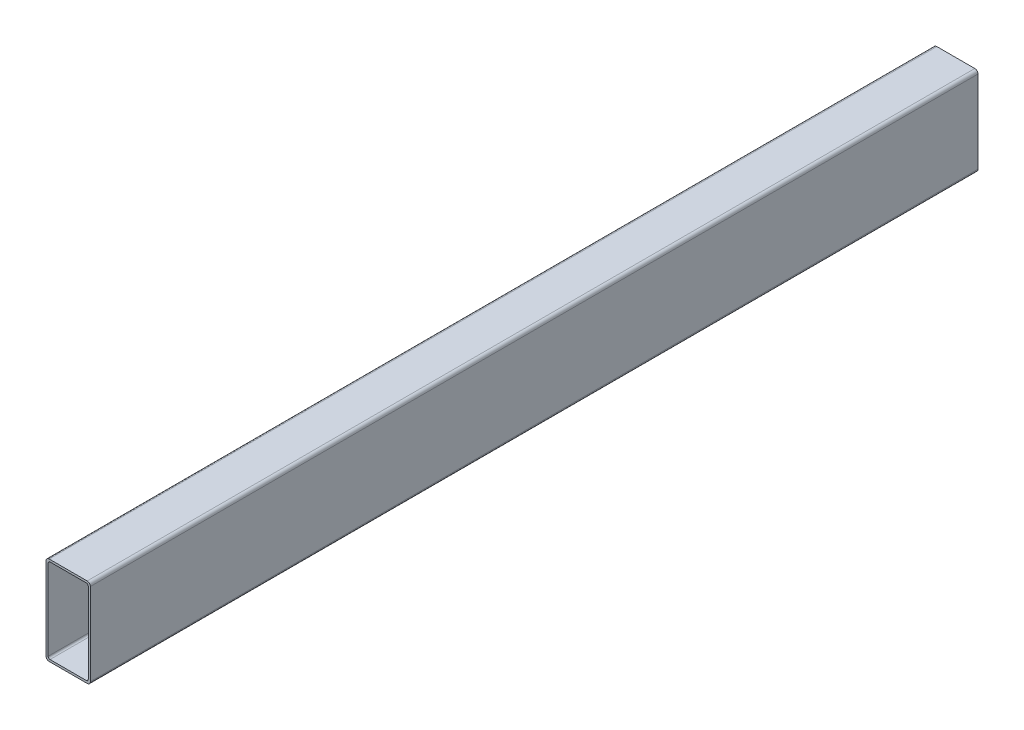
from build123d import *

# Parameters (mm, degrees)
EXTRUDE_1_DEPTH = 500


with BuildPart() as part:
    # 草图1 → 拉伸1 (new body)
    with BuildSketch(Plane.XY):
        with BuildLine():
            Line((-10.704, 25), (10.704, 25))
            ThreePointArc((10.704, 25), (11.973963779, 24.473963779), (12.5, 23.204))
            Line((12.5, 23.204), (12.5, -23.204))
            ThreePointArc((12.5, -23.204), (11.973963779, -24.473963779), (10.704, -25))
            Line((10.704, -25), (-10.704, -25))
            ThreePointArc((-10.704, -25), (-11.973963779, -24.473963779), (-12.5, -23.204))
            Line((-12.5, -23.204), (-12.5, 23.204))
            ThreePointArc((-12.5, 23.204), (-11.973963779, 24.473963779), (-10.704, 25))
        make_face()
        with BuildLine():
            Line((-10.252, 23.8), (10.252, 23.8))
            ThreePointArc((10.252, 23.8), (10.993047907, 23.493047907), (11.3, 22.752))
            Line((11.3, 22.752), (11.3, -22.752))
            ThreePointArc((11.3, -22.752), (10.993047907, -23.493047907), (10.252, -23.8))
            Line((10.252, -23.8), (-10.252, -23.8))
            ThreePointArc((-10.252, -23.8), (-10.993047907, -23.493047907), (-11.3, -22.752))
            Line((-11.3, -22.752), (-11.3, 22.752))
            ThreePointArc((-11.3, 22.752), (-10.993047907, 23.493047907), (-10.252, 23.8))
        make_face(mode=Mode.SUBTRACT)
    extrude(amount=EXTRUDE_1_DEPTH)


solid = part.part
